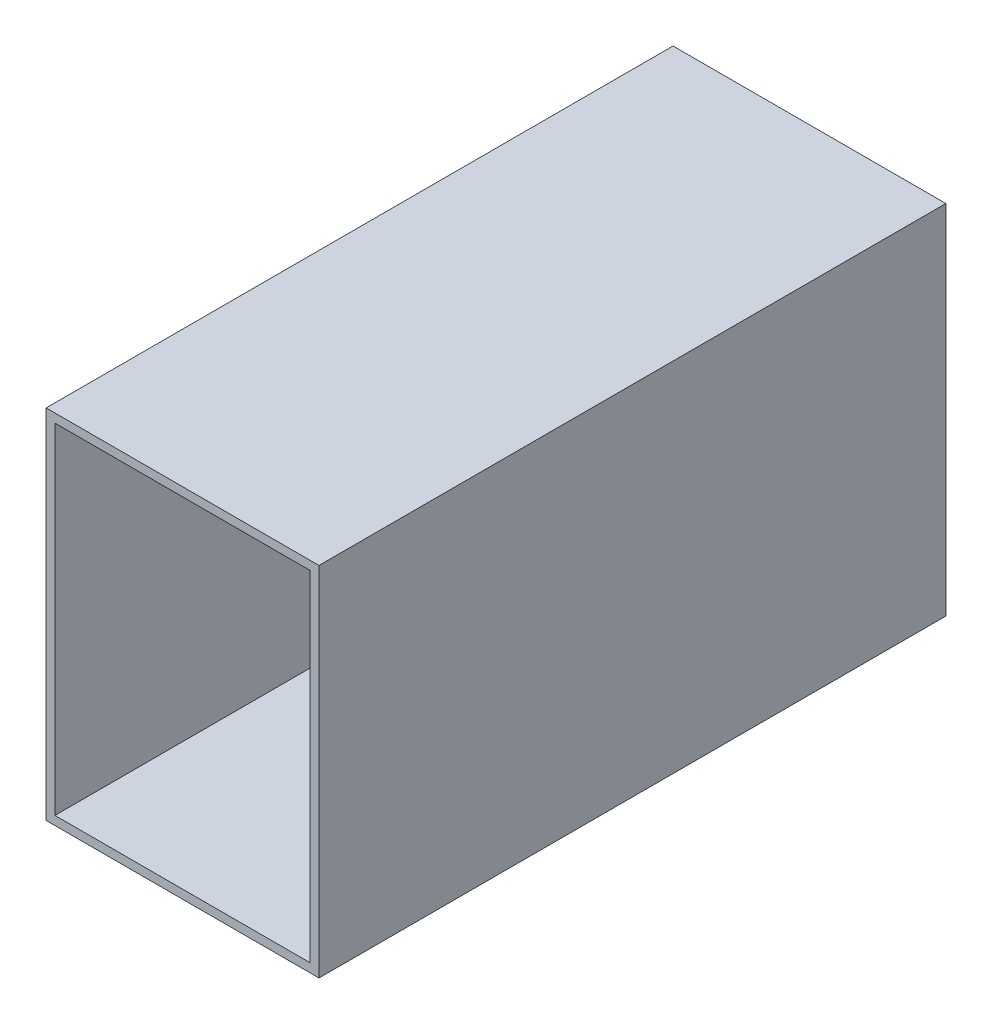
from build123d import *

# Parameters (mm, degrees)
ESQUISSE1_W        = 840
ESQUISSE1_H        = 1100
BOSS_EXTRU_1_DEPTH = 30
ESQUISSE2_W        = 840
ESQUISSE2_H        = 1100
ESQUISSE2_W_2      = 786
ESQUISSE2_H_2      = 1046
BOSS_EXTRU_2_DEPTH = 1900
ESQUISSE4_W        = 786
ESQUISSE4_H        = 27
BOSS_EXTRU_3_DEPTH = 540


with BuildPart() as part:
    # Esquisse1 → Boss.-Extru.1 (new body)
    with BuildSketch(Plane.XY):
        with Locations((420, 550)):
            Rectangle(ESQUISSE1_W, ESQUISSE1_H)
    extrude(amount=BOSS_EXTRU_1_DEPTH)

    # Esquisse2 → Boss.-Extru.2 (add)
    with BuildSketch(Plane.XY.offset(30)):
        with Locations((420, 550)):
            Rectangle(ESQUISSE2_W, ESQUISSE2_H)
        with Locations((420, 550)):
            Rectangle(ESQUISSE2_W_2, ESQUISSE2_H_2, mode=Mode.SUBTRACT)
    extrude(amount=BOSS_EXTRU_2_DEPTH)

    # Esquisse4 → Boss.-Extru.3 (add)
    with BuildSketch(Plane(origin=(0, 1100, 0), x_dir=(1, 0, 0), z_dir=(0, 1, 0))):
        with Locations((420, -443.5)):
            Rectangle(ESQUISSE4_W, ESQUISSE4_H)
    extrude(amount=-BOSS_EXTRU_3_DEPTH)


solid = part.part
